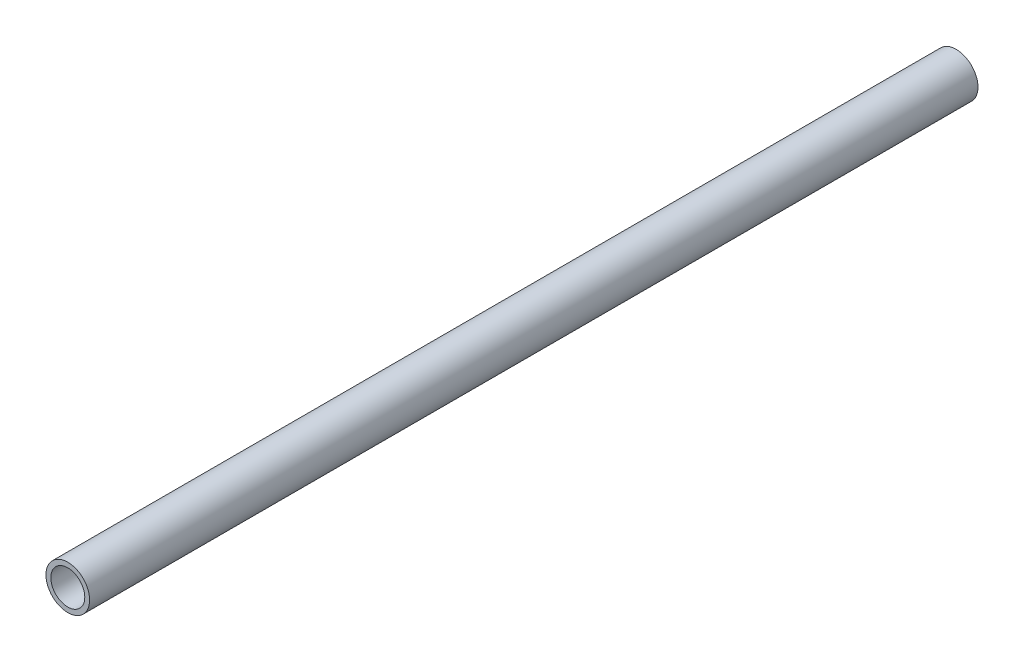
from build123d import *

# Parameters (mm, degrees)
SKETCH1_R           = 9
SKETCH1_R_2         = 7
BOSS_EXTRUDE1_DEPTH = 366.18


with BuildPart() as part:
    # Sketch1 → Boss-Extrude1 (new body)
    with BuildSketch(Plane.XY):
        Circle(SKETCH1_R)
        Circle(SKETCH1_R_2, mode=Mode.SUBTRACT)
    extrude(amount=BOSS_EXTRUDE1_DEPTH)


solid = part.part
